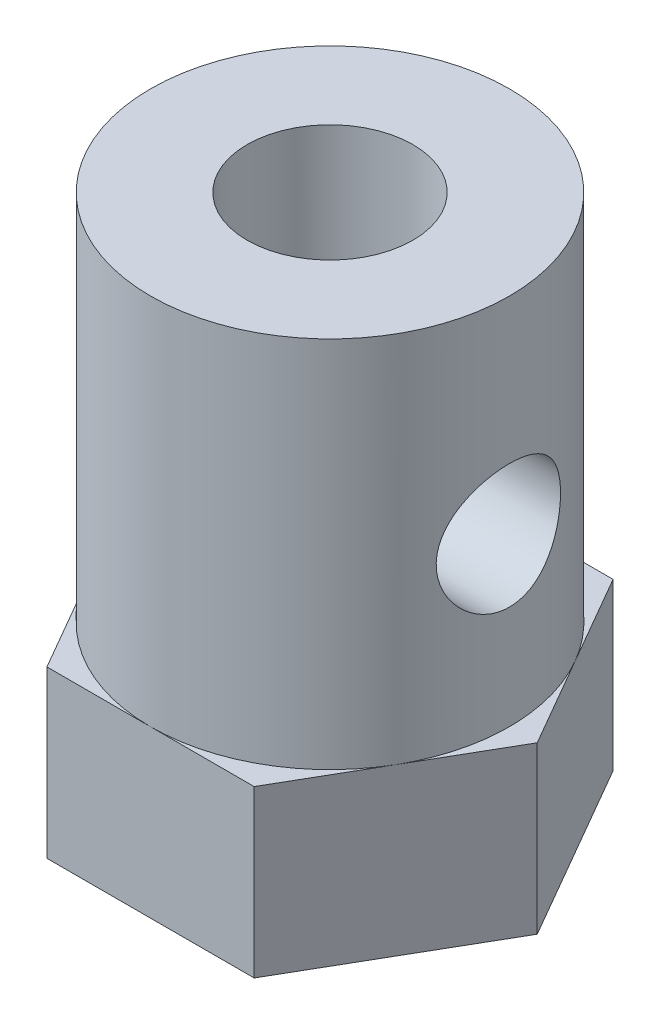
from build123d import *

# Parameters (mm, degrees)
EXTRUDE_1_DEPTH          = 4
SKETCH_3_R               = 4.330127019
SKETCH_3_R_2             = 2
EXTRUDE_2_DEPTH          = 9
SKETCH_4_R               = 1.5
CUT_EXTRUDE_1_DEPTH      = 15
CUT_EXTRUDE_2_DEPTH      = 15.585952146
CUT_EXTRUDE_2_DEPTH_BACK = 15.585952146
SKETCH_5_R               = 1.5


with BuildPart() as part:
    # 草图2 → 凸台-拉伸1 (new body)
    with BuildSketch(Plane(origin=(0, 0, 0), x_dir=(1, 0, 0), z_dir=(0, 1, 0))):
        Polygon((0, 0), (-2.5, 4.330127019), (-5, 0), align=None)
        Polygon((-2.5, -4.330127019), (-5, 0), (0, 0), align=None)
        Polygon((0, 0), (-2.5, -4.330127019), (2.5, -4.330127019), align=None)
        Polygon((0, 0), (2.5, -4.330127019), (5, 0), align=None)
        Polygon((0, 0), (5, 0), (2.5, 4.330127019), align=None)
        Polygon((0, 0), (2.5, 4.330127019), (-2.5, 4.330127019), align=None)
    extrude(amount=EXTRUDE_1_DEPTH)

    # 草图3 → 凸台-拉伸2 (add)
    with BuildSketch(Plane(origin=(0, 4, 0), x_dir=(1, 0, 0), z_dir=(0, 1, 0))):
        with Locations(Location((0, 0, 0), (0, 0, 270))):
            Circle(SKETCH_3_R)
        with Locations(Location((0, 0, 0), (0, 0, 270))):
            Circle(SKETCH_3_R_2, mode=Mode.SUBTRACT)
    extrude(amount=EXTRUDE_2_DEPTH)

    # 草图4 → 切除-拉伸1 (cut)
    with BuildSketch(Plane.XZ):
        with Locations(Location((0, 0, 0), (0, 0, 270))):
            Circle(SKETCH_4_R)
    extrude(amount=-CUT_EXTRUDE_1_DEPTH, mode=Mode.SUBTRACT)

    # 草图5 → 切除-拉伸2 (cut, two sides: drawn at the far end of the back side and taken through both)
    with BuildSketch(Plane(origin=(0, 0, 0), x_dir=(0, 0, -1), z_dir=(1, 0, 0)).offset(-CUT_EXTRUDE_2_DEPTH_BACK)):
        with Locations((0, 8)):
            Circle(SKETCH_5_R)
    extrude(amount=CUT_EXTRUDE_2_DEPTH + CUT_EXTRUDE_2_DEPTH_BACK, mode=Mode.SUBTRACT)


solid = part.part
